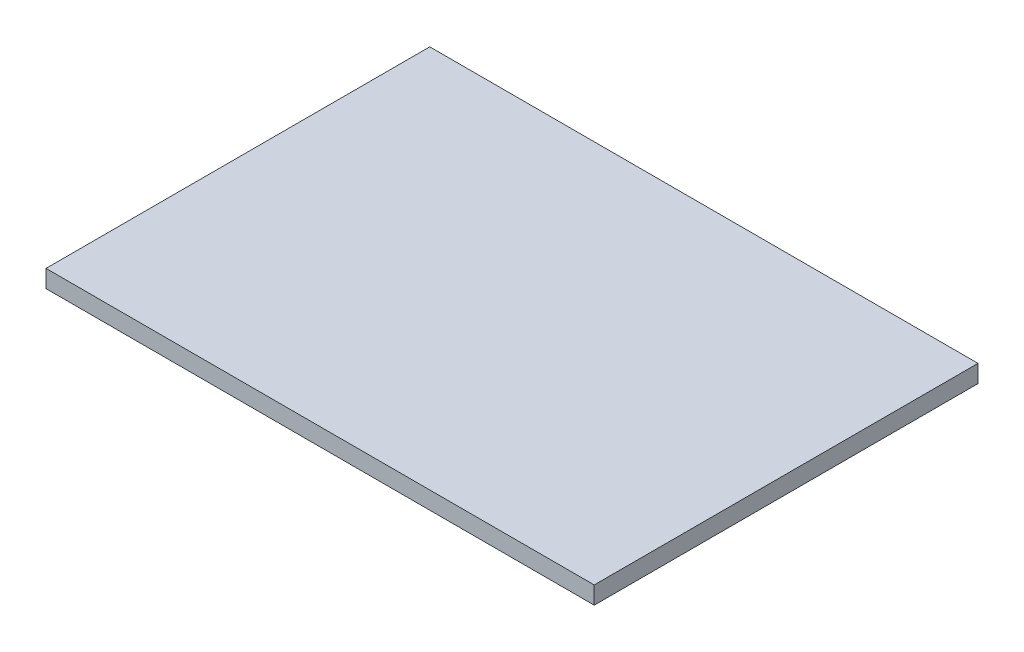
from build123d import *

# Parameters (mm, degrees)
SKETCH1_W           = 250
SKETCH1_H           = 175
BOSS_EXTRUDE1_DEPTH = 8


with BuildPart() as part:
    # Sketch1 → Boss-Extrude1 (new body)
    with BuildSketch(Plane(origin=(0, 0, 0), x_dir=(1, 0, 0), z_dir=(0, 1, 0))):
        Rectangle(SKETCH1_W, SKETCH1_H)
    extrude(amount=BOSS_EXTRUDE1_DEPTH)


solid = part.part
